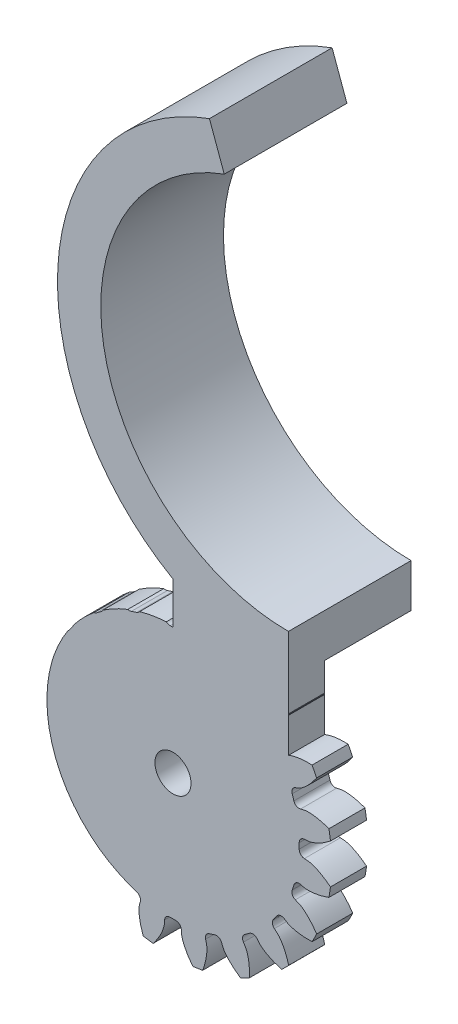
from build123d import *

# Parameters (mm, degrees)
SKETCH_1_R          = 22
LASHENA_DEPTH       = 5
CUT_EXTRUDEA_DEPTH  = 50
WWW_KYTOOL_CN_COUNT = 20
EXTRUDE_1_DEPTH     = 5
EXTRUDE_START       = 12
EXTRUDE_2_DEPTH     = 12
SKETCH_4_R          = 2.5
CUT_EXTRUDE_1_DEPTH = 85.810254692


with BuildPart() as part:
    # 草图1 → LaShenA (new body)
    with BuildSketch(Plane.XY):
        Circle(SKETCH_1_R)
    extrude(amount=LASHENA_DEPTH)

    # SketchA → Cut-ExtrudeA (cut)
    with BuildSketch(Plane.XY.offset(5)):
        with BuildLine():
            ThreePointArc((0.385333897, 17.495757137), (0, 17.5), (-0.385333897, 17.495757137))
            ThreePointArc((-0.385333897, 17.495757137), (-0.916561283, 17.696200843), (-1.1606309, 18.208851052))
            add(Edge.make_bspline(
                [(-1.1606309, 18.208851052), (-1.171930077, 18.392301345), (-1.176241251, 18.632580428), (-1.216058012, 18.896848962), (-1.240743696, 19.008516991), (-1.262518892, 19.096928039), (-1.290499427, 19.198195385), (-1.325289132, 19.312068627), (-1.3676305, 19.438230848), (-1.418205326, 19.576348168), (-1.477697907, 19.726054242), (-1.546773605, 19.886955785), (-1.626084178, 20.058631495), (-1.716264818, 20.240633083), (-1.81793375, 20.432485693), (-1.931691083, 20.633688556), (-2.058117912, 20.843715613), (-2.197775372, 21.062016196), (-2.351203737, 21.28801573), (-2.518921525, 21.521116464), (-2.701424703, 21.760698239), (-2.899185586, 22.006119297), (-3.189864756, 22.34735877), (-3.423201244, 22.599173394), (-3.58629474, 22.766196042)],
                knots=[0.125068197, 0.125068197, 0.125068197, 0.125068197, 0.215847125, 0.244833276, 0.257593391, 0.272673526, 0.290073681, 0.309793857, 0.331834054, 0.356194271, 0.382874509, 0.411874767, 0.443195046, 0.476835345, 0.512795666, 0.551076006, 0.591676368, 0.634596749, 0.679837152, 0.727397575, 0.777278019, 0.829478483, 0.883998968, 1, 1, 1, 1], degree=3))
            ThreePointArc((-3.58629474, 22.766196042), (0, 23.046934551), (3.58629474, 22.766196042))
            add(Edge.make_bspline(
                [(1.1606309, 18.208851052), (1.171930077, 18.392301345), (1.176241251, 18.632580428), (1.216058012, 18.896848962), (1.240743696, 19.008516991), (1.262518892, 19.096928039), (1.290499427, 19.198195385), (1.325289132, 19.312068627), (1.3676305, 19.438230848), (1.418205326, 19.576348168), (1.477697907, 19.726054242), (1.546773605, 19.886955785), (1.626084178, 20.058631495), (1.716264818, 20.240633083), (1.81793375, 20.432485693), (1.931691083, 20.633688556), (2.058117912, 20.843715613), (2.197775372, 21.062016196), (2.351203737, 21.28801573), (2.518921525, 21.521116464), (2.701424703, 21.760698239), (2.899185586, 22.006119297), (3.189864756, 22.34735877), (3.423201244, 22.599173394), (3.58629474, 22.766196042)],
                knots=[0.125068197, 0.125068197, 0.125068197, 0.125068197, 0.215847125, 0.244833276, 0.257593391, 0.272673526, 0.290073681, 0.309793857, 0.331834054, 0.356194271, 0.382874509, 0.411874767, 0.443195046, 0.476835345, 0.512795666, 0.551076006, 0.591676368, 0.634596749, 0.679837152, 0.727397575, 0.777278019, 0.829478483, 0.883998968, 1, 1, 1, 1], degree=3))
            ThreePointArc((1.1606309, 18.208851052), (0.916561283, 17.696200843), (0.385333897, 17.495757137))
        make_face()
    cut_extrudea = extrude(amount=-CUT_EXTRUDEA_DEPTH, mode=Mode.SUBTRACT)

    # www.KYTool.cn: Cut-ExtrudeA ×20 about axis
    www_kytool_cn_axis = Axis((0, 0, -88.99), (0, 0, 1))
    for i in range(1, WWW_KYTOOL_CN_COUNT):
        add(cut_extrudea.rotate(www_kytool_cn_axis, i * 360 / WWW_KYTOOL_CN_COUNT), mode=Mode.SUBTRACT)

    # 草图2 → 凸台-拉伸1 (add)
    with BuildSketch(Plane(origin=(0, 0, 0), x_dir=(-1, 0, 0), z_dir=(0, 0, -1))):
        with BuildLine():
            Line((-16, 0), (-16, 25))
            ThreePointArc((-16, 25), (9.605001578, 46.485147381), (-7.107476274, 75.43200814))
            Line((-7.107476274, 75.43200814), (-5.055355414, 81.070163865))
            ThreePointArc((-5.055355414, 81.070163865), (15.878230339, 53.788983768), (0, 23.287187079))
            Line((0, 23.287187079), (0, 16))
            ThreePointArc((0, 16), (-11.313708499, 11.313708499), (-16, 0))
        make_face()
    extrude(amount=-EXTRUDE_1_DEPTH)

    # 草图3 → 凸台-拉伸2 (add)
    with BuildSketch(Plane(origin=(0, 0, 0), x_dir=(-1, 0, 0), z_dir=(0, 0, -1)).offset(EXTRUDE_START)):
        with BuildLine():
            Line((-5.055355414, 81.070163865), (-7.107476274, 75.43200814))
            ThreePointArc((-7.107476274, 75.43200814), (9.605001578, 46.485147381), (-16, 25))
            Line((-16, 25), (-16, 19))
            ThreePointArc((-16, 19), (15.513848096, 45.443258315), (-5.055355414, 81.070163865))
        make_face()
    extrude(amount=-EXTRUDE_2_DEPTH)

    # 草图4 → 切除-拉伸1 (cut, through all)
    with BuildSketch(Plane(origin=(0, 0, 0), x_dir=(-1, 0, 0), z_dir=(0, 0, -1))):
        Circle(SKETCH_4_R)
        with BuildLine():
            Line((0.916561283, 17.696200843), (0.916561283, 23.505109149))
            Line((0.916561283, 23.505109149), (17.292610336, 22.10082229))
            Line((17.292610336, 22.10082229), (29.568883126, 0.088525695))
            Line((29.568883126, 0.088525695), (13.294454282, -24.523554531))
            Line((13.294454282, -24.523554531), (5.772960598, -24.523554531))
            Line((5.772960598, -24.523554531), (5.772960598, -16.52037911))
            ThreePointArc((5.772960598, -16.52037911), (17.292610336, 2.567545487), (0.916561283, 17.696200843))
        make_face()
    extrude(amount=-CUT_EXTRUDE_1_DEPTH, mode=Mode.SUBTRACT)


solid = part.part
